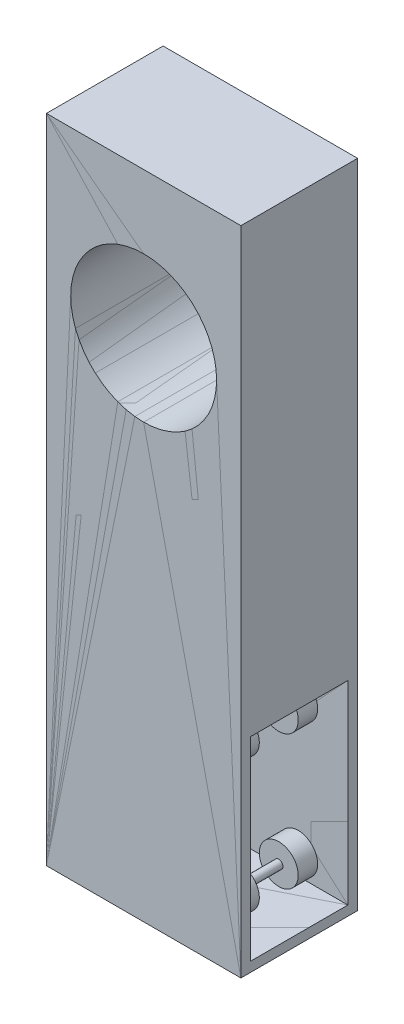
from build123d import *

# Parameters (mm, degrees)
SKETCH1_W           = 30.48
SKETCH1_H           = 55.88
SKETCH1_W_2         = 25.4
SKETCH1_H_2         = 50.8
BOSS_EXTRUDE1_DEPTH = 50.8
SKETCH6_R           = 5.08
SKETCH6_R_2         = 1.101729558
BOSS_EXTRUDE2_DEPTH = 2.54
SKETCH7_R           = 1.101729558
BOSS_EXTRUDE3_DEPTH = 25.4
SKETCH8_W           = 50.8
SKETCH8_H           = 30.48
BOSS_EXTRUDE4_DEPTH = 114.3
SKETCH9_R           = 19.05
CUT_EXTRUDE1_DEPTH  = 155.084029023


with BuildPart() as part:
    # Sketch1 → Boss-Extrude1 (new body)
    with BuildSketch(Plane(origin=(0, 0, 0), x_dir=(0, 0, -1), z_dir=(1, 0, 0))):
        Rectangle(SKETCH1_W, SKETCH1_H)
        Rectangle(SKETCH1_W_2, SKETCH1_H_2, mode=Mode.SUBTRACT)
    extrude(amount=BOSS_EXTRUDE1_DEPTH)



with BuildPart() as body_2:
    # Sketch6 → Boss-Extrude2 (new, symmetric)
    with BuildSketch(Plane.XY.offset(-7.62)):
        with Locations((10.430433186, 17.544167119)):
            Circle(SKETCH6_R)
        with Locations((10.430433186, 17.544167119)):
            Circle(SKETCH6_R_2, mode=Mode.SUBTRACT)
    extrude(amount=BOSS_EXTRUDE2_DEPTH, both=True)


with BuildPart() as body_3:
    # Mirror6: mirrored copy
    add(body_2.part.mirror(Plane.XY))


with BuildPart() as body_4:
    # Mirror7: mirrored copy
    add(body_2.part.mirror(Plane(origin=(0, 0, 0), x_dir=(0, 0, 1), z_dir=(0, -1, 0))))


with BuildPart() as body_5:
    # Mirror7 2: mirrored copy
    add(body_3.part.mirror(Plane(origin=(0, 0, 0), x_dir=(0, 0, 1), z_dir=(0, -1, 0))))


with BuildPart() as part_1:
    add(part.part)

    add(body_2.part)  # Boss-Extrude3 merges body 2

    add(body_3.part)  # Boss-Extrude3 merges body 3
    # Sketch7 → Boss-Extrude3 (add)
    with BuildSketch(Plane.XY.offset(-12.7)):
        with Locations(Location((10.430433186, 17.544167119, 0), (0, 0, 180))):
            Circle(SKETCH7_R)
    extrude(amount=BOSS_EXTRUDE3_DEPTH)


with BuildPart() as body_4_2:
    # Mirror8: mirrored copy
    add(part_1.part.mirror(Plane(origin=(0, 0, 0), x_dir=(0, 0, 1), z_dir=(0, -1, 0))))


with BuildPart() as part_2:
    add(part_1.part)

    add(body_4_2.part)  # Boss-Extrude4 merges body 4 2
    # Sketch8 → Boss-Extrude4 (add)
    with BuildSketch(Plane(origin=(0, 27.94, 0), x_dir=(1, 0, 0), z_dir=(0, 1, 0))):
        with Locations((25.4, 0)):
            Rectangle(SKETCH8_W, SKETCH8_H)
    extrude(amount=BOSS_EXTRUDE4_DEPTH)


with BuildPart() as body_4_3:
    # Mirror10: mirrored copy
    add(part_2.part.mirror(Plane(origin=(25.4, 0, 0), x_dir=(0, 0, 1), z_dir=(1, 0, 0))))


with BuildPart() as cut_extrude1_tool:
    # Sketch9 → Cut-Extrude1 (new, through all)
    with BuildSketch(Plane.XY.offset(15.24)):
        with Locations((25.4, 104.14)):
            Circle(SKETCH9_R)
    extrude(amount=-CUT_EXTRUDE1_DEPTH)


with BuildPart() as part_3:
    add(part_2.part)

    # Cut-Extrude1: cut by cut_extrude1_tool
    add(cut_extrude1_tool.part, mode=Mode.SUBTRACT)


with BuildPart() as body_4_3_1:
    add(body_4_3.part)

    # Cut-Extrude1: cut by cut_extrude1_tool
    add(cut_extrude1_tool.part, mode=Mode.SUBTRACT)


solid = Compound([body_4.part, body_5.part, part_3.part, body_4_3_1.part])
